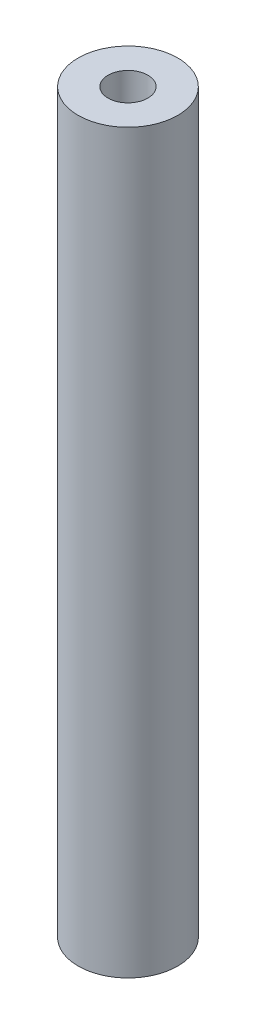
from build123d import *

# Parameters (mm, degrees)
SKETCH1_R           = 5
BOSS_EXTRUDE1_DEPTH = 74
CUT_EXTRUDE1_REACH  = 76.337
SKETCH2_R           = 2


with BuildPart() as part:
    # Sketch1 → Boss-Extrude1 (new body)
    with BuildSketch(Plane(origin=(0, 0, 0), x_dir=(1, 0, 0), z_dir=(0, 1, 0))):
        with Locations(Location((0, 0, 0), (0, 0, 270))):
            Circle(SKETCH1_R)
    extrude(amount=BOSS_EXTRUDE1_DEPTH)

    # Sketch2 → Cut-Extrude1 (cut, up to next)
    with BuildSketch(Plane(origin=(0, 74, 0), x_dir=(1, 0, 0), z_dir=(0, 1, 0)), mode=Mode.PRIVATE) as cut_extrude1_sk1:
        with Locations(Location((0, 0, 0), (0, 0, 270))):
            Circle(SKETCH2_R)
    cut_extrude1_tool1 = extrude(cut_extrude1_sk1.sketch, amount=-CUT_EXTRUDE1_REACH, mode=Mode.PRIVATE) & part.part
    add(cut_extrude1_tool1.solids().sort_by_distance((0, 74, 0))[0], mode=Mode.SUBTRACT)


solid = part.part
